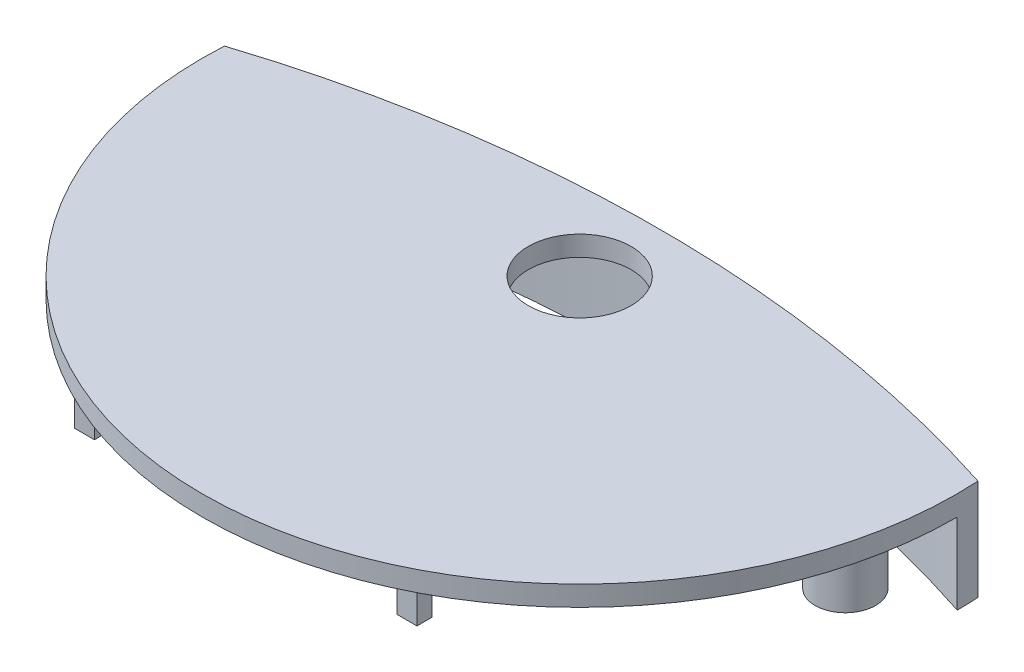
from build123d import *
from build123d.topology import SkipClean

# Parameters (mm, degrees)
SKETCH_1_R      = 5.1
EXTRUDE_1_DEPTH = 2
EXTRUDE_START   = 8
EXTRUDE_2_DEPTH = 8
SKETCH_3_R      = 3
SKETCH_3_R_2    = 1.9
EXTRUDE_3_DEPTH = 6
SKETCH_4_W      = 4
SKETCH_4_H      = 4
SKETCH_4_W_2    = 2
SKETCH_4_H_2    = 1.5
EXTRUDE_4_DEPTH = 2
EXTRUDE_5_DEPTH = 1


with BuildPart() as part:
    # 草图1 → 凸台-拉伸1 (new body)
    with BuildSketch(Plane(origin=(0, 0, 0), x_dir=(1, 0, 0), z_dir=(0, 1, 0))):
        with BuildLine():
            ThreePointArc((-37.388863526, 2.139014778), (0, -37.45), (37.388863526, 2.139014778))
            ThreePointArc((37.388863526, 2.139014778), (0, 8), (-37.388863526, 2.139014778))
        make_face()
        with Locations(Location((0, 0, 0), (0, 0, 270))):
            Circle(SKETCH_1_R, mode=Mode.SUBTRACT)
    extrude(amount=EXTRUDE_1_DEPTH)

    # 草图2 → 凸台-拉伸2 (add)
    with SkipClean():  # the faces are left unmerged after this step: merging them gives an invalid solid
        with BuildSketch(Plane.XZ.offset(EXTRUDE_START)):
            with BuildLine():
                ThreePointArc((37.388863526, -2.139014778), (37.434477455, -1.078145477), (37.449996405, -0.016409414))
                ThreePointArc((37.449996405, -0.016409414), (0, -6), (-37.449996405, -0.016409414))
                ThreePointArc((-37.449996405, -0.016409414), (-37.434477455, -1.078145477), (-37.388863526, -2.139014778))
                ThreePointArc((-37.388863526, -2.139014778), (0, -8), (37.388863526, -2.139014778))
            make_face()
        extrude(amount=-EXTRUDE_2_DEPTH)

    # 草图3 → 凸台-拉伸3 (add)
    # profile 1 of 2: a face of its own
    with SkipClean():  # the faces are left unmerged after this step: merging them gives an invalid solid
        with BuildSketch(Plane.XZ):
            with Locations(Location((-32.006251973, 5.643565774, 0), (0, 0, 270))):
                Circle(SKETCH_3_R)
            with Locations(Location((-32.006251973, 5.643565774, 0), (0, 0, 270))):
                Circle(SKETCH_3_R_2, mode=Mode.SUBTRACT)
        # profile 2 of 2: a face of its own
        with BuildSketch(Plane.XZ):
            with Locations(Location((32.006251973, 5.643565774, 0), (0, 0, 270))):
                Circle(SKETCH_3_R)
            with Locations(Location((32.006251973, 5.643565774, 0), (0, 0, 270))):
                Circle(SKETCH_3_R_2, mode=Mode.SUBTRACT)
        extrude(amount=EXTRUDE_3_DEPTH)

    # 草图4 → 凸台-拉伸4 (add)
    with SkipClean():  # the faces are left unmerged after this step: merging them gives an invalid solid
        with BuildSketch(Plane.XZ):
            with Locations((16, -3.6)):
                Rectangle(SKETCH_4_W, SKETCH_4_H)
            with Locations((-16, -3.6)):
                Rectangle(SKETCH_4_W, SKETCH_4_H)
            with Locations((16, 32.4)):
                Rectangle(SKETCH_4_W_2, SKETCH_4_H_2)
            with Locations((-16, 32.4)):
                Rectangle(SKETCH_4_W_2, SKETCH_4_H_2)
        extrude(amount=EXTRUDE_4_DEPTH)

    # 草图5 → 凸台-拉伸5 (add)
    with SkipClean():  # the faces are left unmerged after this step: merging them gives an invalid solid
        with BuildSketch(Plane.XZ.offset(2)):
            Polygon((-16.1, 32.5), (-16.1, 31.65), (-17, 31.65), (-17, 33.15), (-15, 33.15), (-15, 32.5), align=None)
            Polygon((-16.1, -3.7), (-14, -3.7), (-14, -6.021052632), (-18, -6.021052632), (-18, -1.6), (-16.1, -1.6), align=None)
            Polygon((16.1, -3.7), (16.1, -1.6), (18, -1.6), (18, -5.6), (14, -5.6), (14, -3.7), align=None)
            Polygon((16.1, 32.5), (15, 32.5), (15, 33.15), (17, 33.15), (17, 31.65), (16.1, 31.65), align=None)
        extrude(amount=EXTRUDE_5_DEPTH)


solid = part.part
